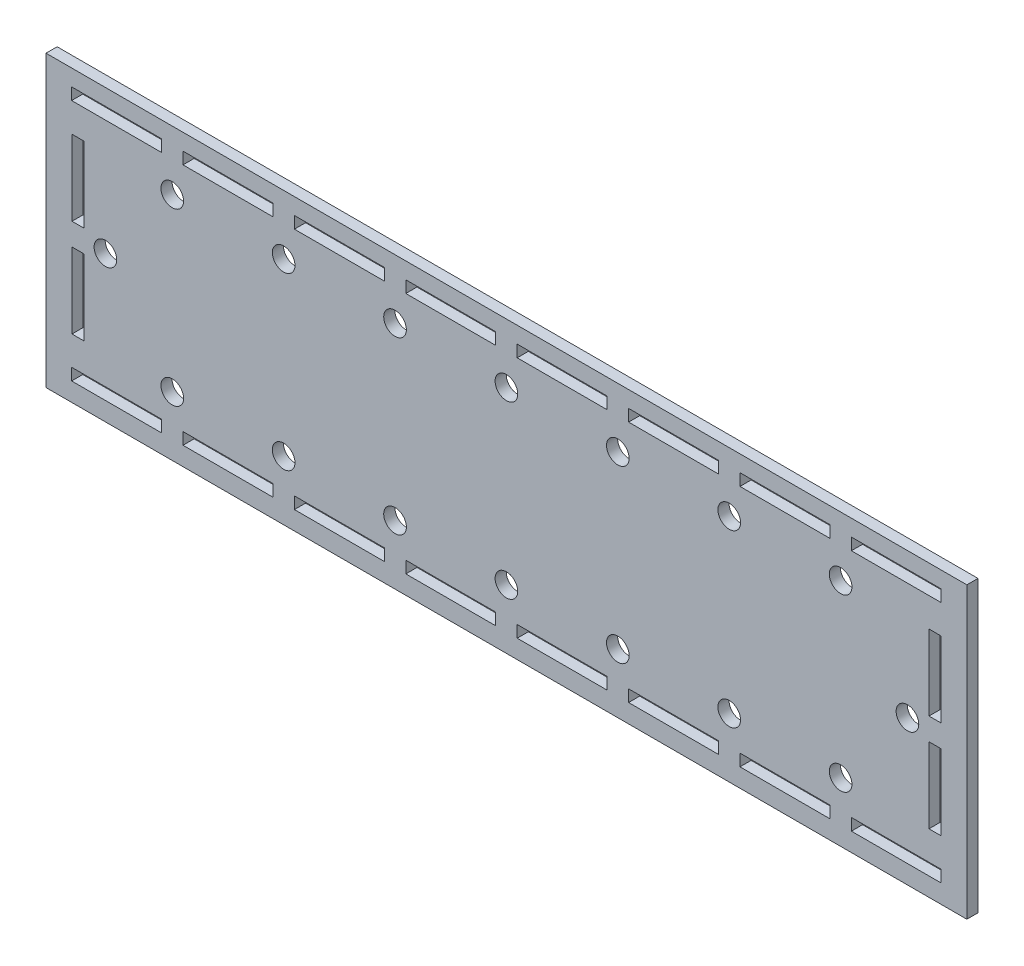
from build123d import *

# Parameters (mm, degrees)
SKETCH1_W           = 248
SKETCH1_H           = 78
SKETCH1_R           = 3.05
SKETCH1_W_2         = 24.2
SKETCH1_H_2         = 3.2
SKETCH1_W_3         = 3.2
SKETCH1_H_3         = 20.3
BOSS_EXTRUDE2_DEPTH = 3


with BuildPart() as part:
    # Sketch1 → Boss-Extrude2 (new body)
    with BuildSketch(Plane(origin=(0, 0, 0), x_dir=(-1, 0, 0), z_dir=(0, 0, 1))):
        with Locations((-428.787224347, 459)):
            Rectangle(SKETCH1_W, SKETCH1_H)
        with Locations(Location((-338.787224347, 436, 0), (0, 0, 180))):
            Circle(SKETCH1_R, mode=Mode.SUBTRACT)
        with Locations(Location((-368.787224347, 436, 0), (0, 0, 180))):
            Circle(SKETCH1_R, mode=Mode.SUBTRACT)
        with Locations(Location((-428.787224347, 436, 0), (0, 0, 180))):
            Circle(SKETCH1_R, mode=Mode.SUBTRACT)
        with Locations(Location((-398.787224347, 436, 0), (0, 0, 180))):
            Circle(SKETCH1_R, mode=Mode.SUBTRACT)
        with Locations(Location((-488.787224347, 436, 0), (0, 0, 180))):
            Circle(SKETCH1_R, mode=Mode.SUBTRACT)
        with Locations(Location((-458.787224347, 436, 0), (0, 0, 180))):
            Circle(SKETCH1_R, mode=Mode.SUBTRACT)
        with Locations(Location((-458.787224347, 482, 0), (0, 0, 180))):
            Circle(SKETCH1_R, mode=Mode.SUBTRACT)
        with Locations(Location((-428.787224347, 482, 0), (0, 0, 180))):
            Circle(SKETCH1_R, mode=Mode.SUBTRACT)
        with Locations(Location((-398.787224347, 482, 0), (0, 0, 180))):
            Circle(SKETCH1_R, mode=Mode.SUBTRACT)
        with Locations(Location((-368.787224347, 482, 0), (0, 0, 180))):
            Circle(SKETCH1_R, mode=Mode.SUBTRACT)
        with Locations(Location((-338.787224347, 482, 0), (0, 0, 180))):
            Circle(SKETCH1_R, mode=Mode.SUBTRACT)
        with Locations(Location((-320.787224347, 458.7, 0), (0, 0, 180))):
            Circle(SKETCH1_R, mode=Mode.SUBTRACT)
        with Locations(Location((-488.787224347, 482, 0), (0, 0, 180))):
            Circle(SKETCH1_R, mode=Mode.SUBTRACT)
        with Locations(Location((-518.787224347, 436, 0), (0, 0, 180))):
            Circle(SKETCH1_R, mode=Mode.SUBTRACT)
        with Locations(Location((-536.787224347, 459, 0), (0, 0, 180))):
            Circle(SKETCH1_R, mode=Mode.SUBTRACT)
        with Locations(Location((-518.787224347, 482, 0), (0, 0, 180))):
            Circle(SKETCH1_R, mode=Mode.SUBTRACT)
        with Locations((-383.787224347, 491.4)):
            Rectangle(SKETCH1_W_2, SKETCH1_H_2, mode=Mode.SUBTRACT)
        with Locations((-413.787224347, 491.4)):
            Rectangle(SKETCH1_W_2, SKETCH1_H_2, mode=Mode.SUBTRACT)
        with Locations((-353.787224347, 491.4)):
            Rectangle(SKETCH1_W_2, SKETCH1_H_2, mode=Mode.SUBTRACT)
        with Locations((-443.787224347, 491.4)):
            Rectangle(SKETCH1_W_2, SKETCH1_H_2, mode=Mode.SUBTRACT)
        with Locations((-473.787224347, 491.4)):
            Rectangle(SKETCH1_W_2, SKETCH1_H_2, mode=Mode.SUBTRACT)
        with Locations((-503.787224347, 491.4)):
            Rectangle(SKETCH1_W_2, SKETCH1_H_2, mode=Mode.SUBTRACT)
        with Locations((-533.787224347, 491.4)):
            Rectangle(SKETCH1_W_2, SKETCH1_H_2, mode=Mode.SUBTRACT)
        with Locations((-323.787224347, 491.4)):
            Rectangle(SKETCH1_W_2, SKETCH1_H_2, mode=Mode.SUBTRACT)
        with Locations((-313.387224347, 445.55)):
            Rectangle(SKETCH1_W_3, SKETCH1_H_3, mode=Mode.SUBTRACT)
        with Locations((-313.387224347, 471.85)):
            Rectangle(SKETCH1_W_3, SKETCH1_H_3, mode=Mode.SUBTRACT)
        with Locations((-544.187224347, 445.55)):
            Rectangle(SKETCH1_W_3, SKETCH1_H_3, mode=Mode.SUBTRACT)
        with Locations((-544.187224347, 471.85)):
            Rectangle(SKETCH1_W_3, SKETCH1_H_3, mode=Mode.SUBTRACT)
        with Locations((-533.787224347, 426)):
            Rectangle(SKETCH1_W_2, SKETCH1_H_2, mode=Mode.SUBTRACT)
        with Locations((-503.787224347, 426)):
            Rectangle(SKETCH1_W_2, SKETCH1_H_2, mode=Mode.SUBTRACT)
        with Locations((-473.787224347, 426)):
            Rectangle(SKETCH1_W_2, SKETCH1_H_2, mode=Mode.SUBTRACT)
        with Locations((-443.787224347, 426)):
            Rectangle(SKETCH1_W_2, SKETCH1_H_2, mode=Mode.SUBTRACT)
        with Locations((-413.787224347, 426)):
            Rectangle(SKETCH1_W_2, SKETCH1_H_2, mode=Mode.SUBTRACT)
        with Locations((-383.787224347, 426)):
            Rectangle(SKETCH1_W_2, SKETCH1_H_2, mode=Mode.SUBTRACT)
        with Locations((-353.787224347, 426)):
            Rectangle(SKETCH1_W_2, SKETCH1_H_2, mode=Mode.SUBTRACT)
        with Locations((-323.787224347, 426)):
            Rectangle(SKETCH1_W_2, SKETCH1_H_2, mode=Mode.SUBTRACT)
    extrude(amount=BOSS_EXTRUDE2_DEPTH)


solid = part.part
